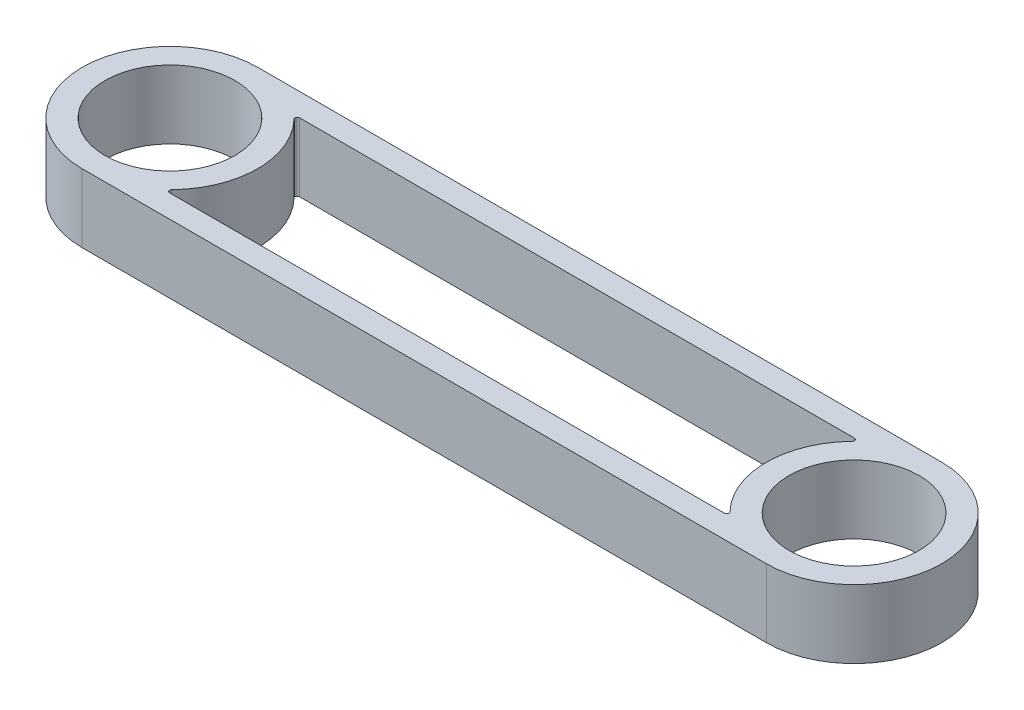
from build123d import *

# Parameters (mm, degrees)
SKETCH_1_R      = 28.5
EXTRUDE_1_DEPTH = 30


with BuildPart() as part:
    # 草图1 → 凸台-拉伸1 (new body)
    with BuildSketch(Plane(origin=(0, 0, 0), x_dir=(1, 0, 0), z_dir=(0, 1, 0))):
        with BuildLine():
            Line((0, -38.5), (300, -38.5))
            ThreePointArc((300, -38.5), (338.5, 0), (300, 38.5))
            Line((300, 38.5), (0, 38.5))
            ThreePointArc((0, 38.5), (-38.5, 0), (0, -38.5))
        make_face()
        with Locations(Location((0, 0, 0), (0, 0, 270))):
            Circle(SKETCH_1_R, mode=Mode.SUBTRACT)
        with Locations(Location((300, 0, 0), (0, 0, 90))):
            Circle(SKETCH_1_R, mode=Mode.SUBTRACT)
        with BuildLine():
            Line((28.354893758, -28.5), (271.645106242, -28.5))
            ThreePointArc((271.645106242, -28.5), (272.566030379, -27.889741881), (272.362951654, -26.803797468))
            ThreePointArc((272.362951654, -26.803797468), (261.5, 0), (272.362951654, 26.803797468))
            ThreePointArc((272.362951654, 26.803797468), (272.566030379, 27.889741881), (271.645106242, 28.5))
            Line((271.645106242, 28.5), (28.354893758, 28.5))
            ThreePointArc((28.354893758, 28.5), (27.433969621, 27.889741881), (27.637048346, 26.803797468))
            ThreePointArc((27.637048346, 26.803797468), (38.5, 0), (27.637048346, -26.803797468))
            ThreePointArc((27.637048346, -26.803797468), (27.433969621, -27.889741881), (28.354893758, -28.5))
        make_face(mode=Mode.SUBTRACT)
    extrude(amount=EXTRUDE_1_DEPTH)


solid = part.part
